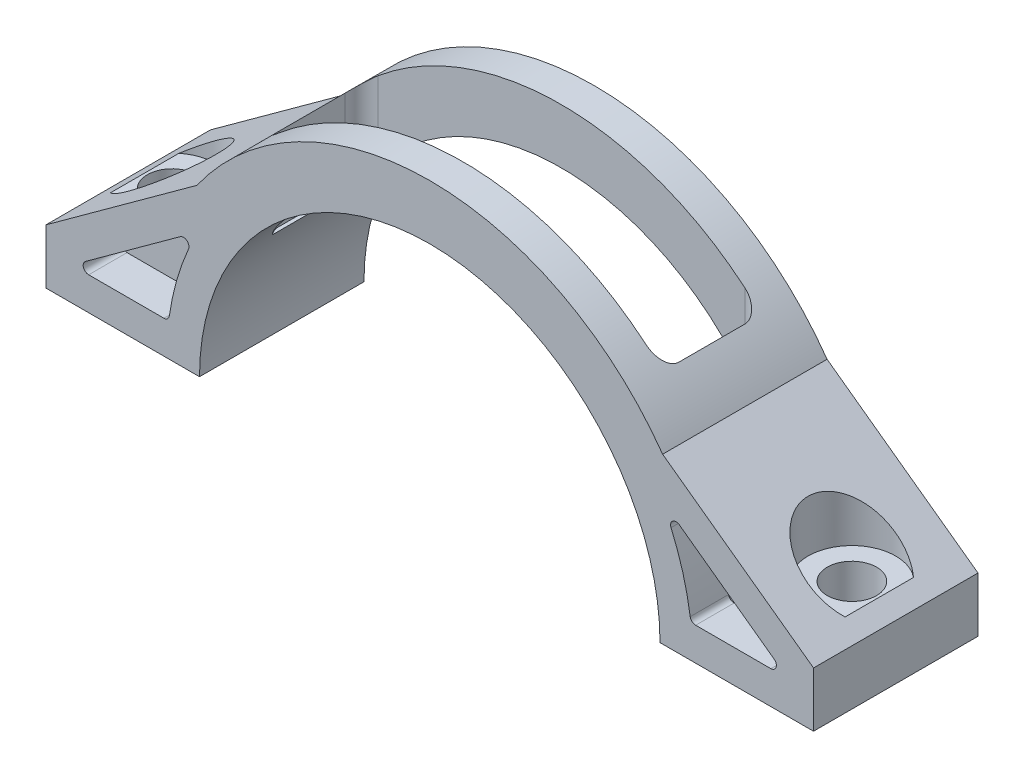
from build123d import *

# Parameters (mm, degrees)
SALIENTE_EXTRUIR1_DEPTH = 7.5
SALIENTE_EXTRUIR2_DEPTH = 7.5
CROQUIS3_R              = 2.25
CORTAR_EXTRUIR1_DEPTH   = 45.240818256
CROQUIS4_R              = 4
CORTAR_EXTRUIR2_DEPTH   = 41.959224846
CORTAR_EXTRUIR3_DEPTH   = 3.5
CORTAR_EXTRUIR4_DEPTH   = 15
SIMETR_A3_COPY_1_DEPTH  = 3.5


with BuildPart() as part:
    # Croquis1 → Saliente-Extruir1 (new, symmetric)
    with BuildSketch(Plane.XY):
        with BuildLine():
            Line((-26, 0), (-21, 0))
            ThreePointArc((-21, 0), (0, 21), (21, 0))
            Line((21, 0), (26, 0))
            ThreePointArc((26, 0), (0, 26), (-26, 0))
        make_face()
    extrude(amount=SALIENTE_EXTRUIR1_DEPTH, both=True)

    # Croquis2 → Saliente-Extruir2 (add, symmetric)
    with BuildSketch(Plane.XY):
        with BuildLine():
            Line((26, 0), (35, 0))
            Line((35, 0), (35, 5))
            Line((35, 5), (21.236760582, 15))
            ThreePointArc((21.236760582, 15), (24.78059498, 7.869060455), (26, 0))
        make_face()
    saliente_extruir2 = extrude(amount=SALIENTE_EXTRUIR2_DEPTH, both=True)

    # Croquis3 → Cortar-Extruir1 (cut, through all)
    with BuildSketch(Plane.XZ):
        with Locations(Location((31, 0, 0), (0, 0, 270))):
            Circle(CROQUIS3_R)
    cortar_extruir1 = extrude(amount=-CORTAR_EXTRUIR1_DEPTH, mode=Mode.SUBTRACT)

    # Croquis4 → Cortar-Extruir2 (cut, through all)
    with BuildSketch(Plane(origin=(0, 6.09, 0), x_dir=(-1, 0, 0), z_dir=(0, -1, 0))):
        with Locations((-31, 0)):
            Circle(CROQUIS4_R)
    cortar_extruir2 = extrude(amount=-CORTAR_EXTRUIR2_DEPTH, mode=Mode.SUBTRACT)

    # Simetría1: Saliente-Extruir2, Cortar-Extruir1, Cortar-Extruir2 across plane
    add(saliente_extruir2.mirror(Plane(origin=(0, 0, 0), x_dir=(0, 0, 1), z_dir=(1, 0, 0))))
    add(cortar_extruir1.mirror(Plane(origin=(0, 0, 0), x_dir=(0, 0, 1), z_dir=(1, 0, 0))), mode=Mode.SUBTRACT)
    add(cortar_extruir2.mirror(Plane(origin=(0, 0, 0), x_dir=(0, 0, 1), z_dir=(1, 0, 0))), mode=Mode.SUBTRACT)

    # Croquis6 → Cortar-Extruir3 (cut)
    with BuildSketch(Plane.XY.offset(7.5)):
        with BuildLine():
            Line((31.403995152, 3.90450261), (22.755647062, 10.188159987))
            ThreePointArc((22.755647062, 10.188159987), (22.148664364, 10.17350309), (22.003343347, 9.5839909))
            ThreePointArc((22.003343347, 9.5839909), (23.084675568, 6.564887959), (23.753839647, 3.428571429))
            ThreePointArc((23.753839647, 3.428571429), (23.921384471, 3.122035527), (24.248711306, 3))
            Line((24.248711306, 3), (31.110094423, 3))
            ThreePointArc((31.110094423, 3), (31.585621134, 3.34548674), (31.403995152, 3.90450261))
        make_face()
    cortar_extruir3 = extrude(amount=-CORTAR_EXTRUIR3_DEPTH, mode=Mode.SUBTRACT)

    # Simetría2: Cortar-Extruir3 across plane
    add(cortar_extruir3.mirror(Plane.XY), mode=Mode.SUBTRACT)

    # Croquis8 → Cortar-Extruir4 (cut)
    with BuildSketch(Plane(origin=(0, 26, 0), x_dir=(1, 0, 0), z_dir=(0, 1, 0))):
        with BuildLine():
            Line((-16.736760582, -4.5), (16.736760582, -4.5))
            ThreePointArc((16.736760582, -4.5), (17.797420753, -4.060660172), (18.236760582, -3))
            Line((18.236760582, -3), (18.236760582, 3))
            ThreePointArc((18.236760582, 3), (17.797420753, 4.060660172), (16.736760582, 4.5))
            Line((16.736760582, 4.5), (-16.736760582, 4.5))
            ThreePointArc((-16.736760582, 4.5), (-17.797420753, 4.060660172), (-18.236760582, 3))
            Line((-18.236760582, 3), (-18.236760582, -3))
            ThreePointArc((-18.236760582, -3), (-17.797420753, -4.060660172), (-16.736760582, -4.5))
        make_face()
    extrude(amount=-CORTAR_EXTRUIR4_DEPTH, mode=Mode.SUBTRACT)

    # Simetría3: Cortar-Extruir3 across plane
    add(cortar_extruir3.mirror(Plane(origin=(0, 0, 0), x_dir=(0, 0, 1), z_dir=(1, 0, 0))), mode=Mode.SUBTRACT)

    # Simetría3 copy 1 sketch → Simetría3 copy 1 (cut)
    with BuildSketch(Plane(origin=(0, 0, -7.5), x_dir=(-1, 0, 0), z_dir=(0, 0, -1))):
        with BuildLine():
            Line((31.403995152, 3.90450261), (22.755647062, 10.188159987))
            ThreePointArc((22.755647062, 10.188159987), (22.148664364, 10.17350309), (22.003343347, 9.5839909))
            ThreePointArc((22.003343347, 9.5839909), (23.084675568, 6.564887959), (23.753839647, 3.428571429))
            ThreePointArc((23.753839647, 3.428571429), (23.921384471, 3.122035527), (24.248711306, 3))
            Line((24.248711306, 3), (31.110094423, 3))
            ThreePointArc((31.110094423, 3), (31.585621134, 3.34548674), (31.403995152, 3.90450261))
        make_face()
    extrude(amount=-SIMETR_A3_COPY_1_DEPTH, mode=Mode.SUBTRACT)


solid = part.part
